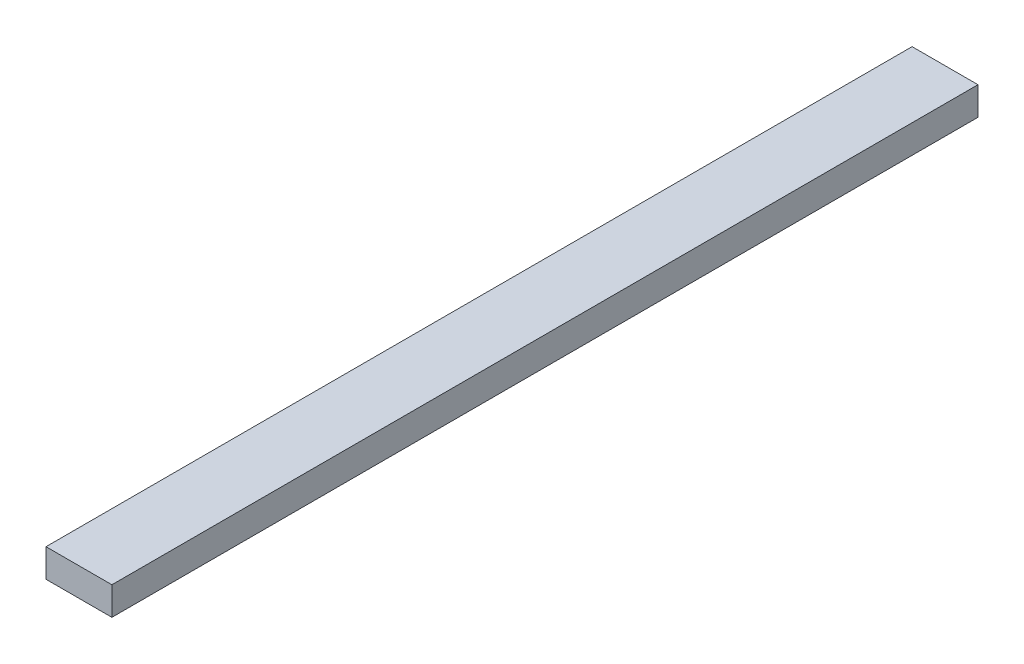
from build123d import *

# Parameters (mm, degrees)
SKETCH1_W           = 88.9
SKETCH1_H           = 38.1
BOSS_EXTRUDE1_DEPTH = 584.2


with BuildPart() as part:
    # Sketch1 → Boss-Extrude1 (new, symmetric)
    with BuildSketch(Plane.XY):
        Rectangle(SKETCH1_W, SKETCH1_H)
    extrude(amount=BOSS_EXTRUDE1_DEPTH, both=True)


solid = part.part
